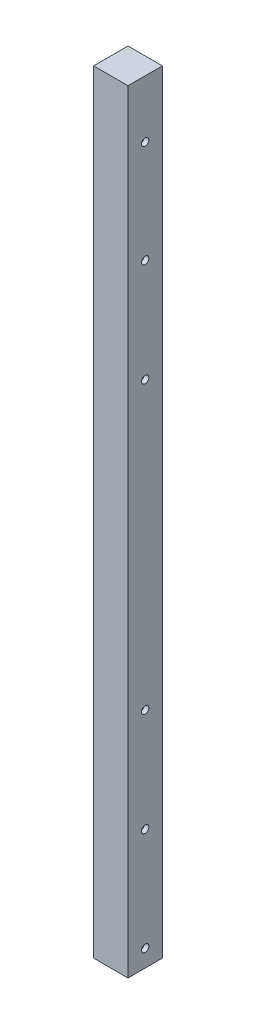
from build123d import *

# Parameters (mm, degrees)
SKETCH1_W           = 15
SKETCH1_H           = 15
SKETCH1_W_2         = 11
SKETCH1_H_2         = 11
BOSS_EXTRUDE1_DEPTH = 337
CUT_EXTRUDE1_DEPTH  = 338.666995722
SKETCH3_R           = 1.6
CUT_EXTRUDE2_DEPTH  = 338.666995722
BOSS_EXTRUDE2_DEPTH = 15


with BuildPart() as part:
    # Sketch1 → Boss-Extrude1 (new body)
    with BuildSketch(Plane(origin=(0, 0, 0), x_dir=(1, 0, 0), z_dir=(0, 1, 0))):
        with Locations((7.5, 7.5)):
            Rectangle(SKETCH1_W, SKETCH1_H)
        with Locations((7.5, 7.5)):
            Rectangle(SKETCH1_W_2, SKETCH1_H_2, mode=Mode.SUBTRACT)
    extrude(amount=BOSS_EXTRUDE1_DEPTH)

    # Sketch2 → Cut-Extrude1 (cut, through all)
    with BuildSketch(Plane(origin=(15, 0, 0), x_dir=(0, 0, -1), z_dir=(1, 0, 0))):
        Polygon((15, 337), (0, 332.980762114), (0, 337), align=None)
    extrude(amount=-CUT_EXTRUDE1_DEPTH, mode=Mode.SUBTRACT)

    # Sketch3 → Cut-Extrude2 (cut, through all)
    with BuildSketch(Plane.ZY):
        with Locations((-7.5, 7.5)):
            Circle(SKETCH3_R)
        with Locations((-7.5, 312)):
            Circle(SKETCH3_R)
        with Locations((-7.5, 267.3)):
            Circle(SKETCH3_R)
        with Locations((-7.5, 52.5)):
            Circle(SKETCH3_R)
        with Locations((-7.5, 97.5)):
            Circle(SKETCH3_R)
        with Locations((-7.5, 222.3)):
            Circle(SKETCH3_R)
    extrude(amount=-CUT_EXTRUDE2_DEPTH, mode=Mode.SUBTRACT)

    # Sketch4 → Boss-Extrude2 (add)
    with BuildSketch(Plane.ZY):
        Polygon((-15, 337), (0, 337), (0, 332.980762114), align=None)
    extrude(amount=-BOSS_EXTRUDE2_DEPTH)


solid = part.part
